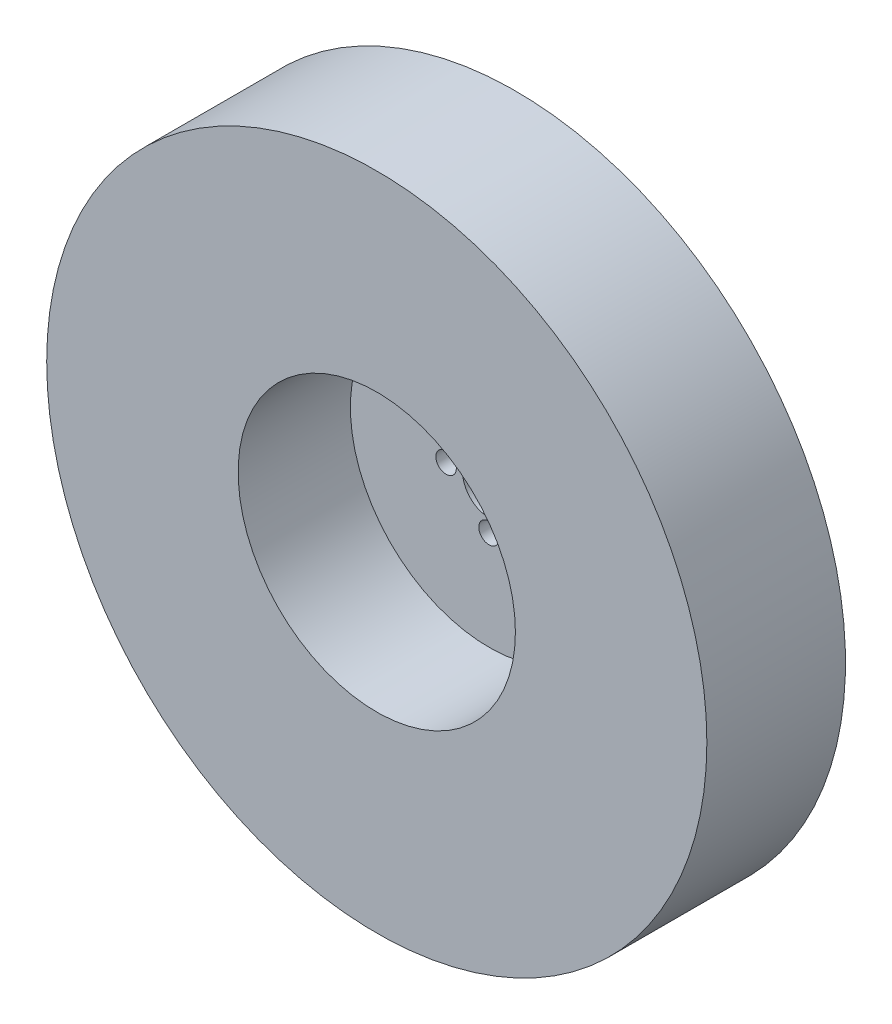
from build123d import *

# Parameters (mm, degrees)
SKETCH_1_R               = 50
SKETCH_1_R_2             = 21
EXTRUDE_1_DEPTH          = 17
EXTRUDE_START            = 4
SKETCH_2_R               = 50
EXTRUDE_2_DEPTH          = 4
CUT_EXTRUDE_1_DEPTH      = 74.763134424
CUT_EXTRUDE_1_DEPTH_BACK = 74.763134424
SKETCH_3_R               = 4
SKETCH_3_R_2             = 1.55


with BuildPart() as part:
    # 草图1 → 凸台-拉伸1 (new body)
    with BuildSketch(Plane.XY):
        Circle(SKETCH_1_R)
        Circle(SKETCH_1_R_2, mode=Mode.SUBTRACT)
    extrude(amount=EXTRUDE_1_DEPTH)

    # 草图2 → 凸台-拉伸2 (add)
    with BuildSketch(Plane(origin=(0, 0, 0), x_dir=(-1, 0, 0), z_dir=(0, 0, -1)).offset(EXTRUDE_START)):
        Circle(SKETCH_2_R)
    extrude(amount=-EXTRUDE_2_DEPTH)

    # 草图3 → 切除-拉伸1 (cut, two sides: drawn at the far end of the back side and taken through both)
    with BuildSketch(Plane(origin=(0, 0, -4), x_dir=(-1, 0, 0), z_dir=(0, 0, -1)).offset(-CUT_EXTRUDE_1_DEPTH_BACK)):
        Circle(SKETCH_3_R)
        with Locations((0, 6)):
            Circle(SKETCH_3_R_2)
        with Locations((0, -6)):
            Circle(SKETCH_3_R_2)
        with Locations((-6.5, 0)):
            Circle(SKETCH_3_R_2)
        with Locations((6.5, 0)):
            Circle(SKETCH_3_R_2)
    extrude(amount=CUT_EXTRUDE_1_DEPTH + CUT_EXTRUDE_1_DEPTH_BACK, mode=Mode.SUBTRACT)


solid = part.part
